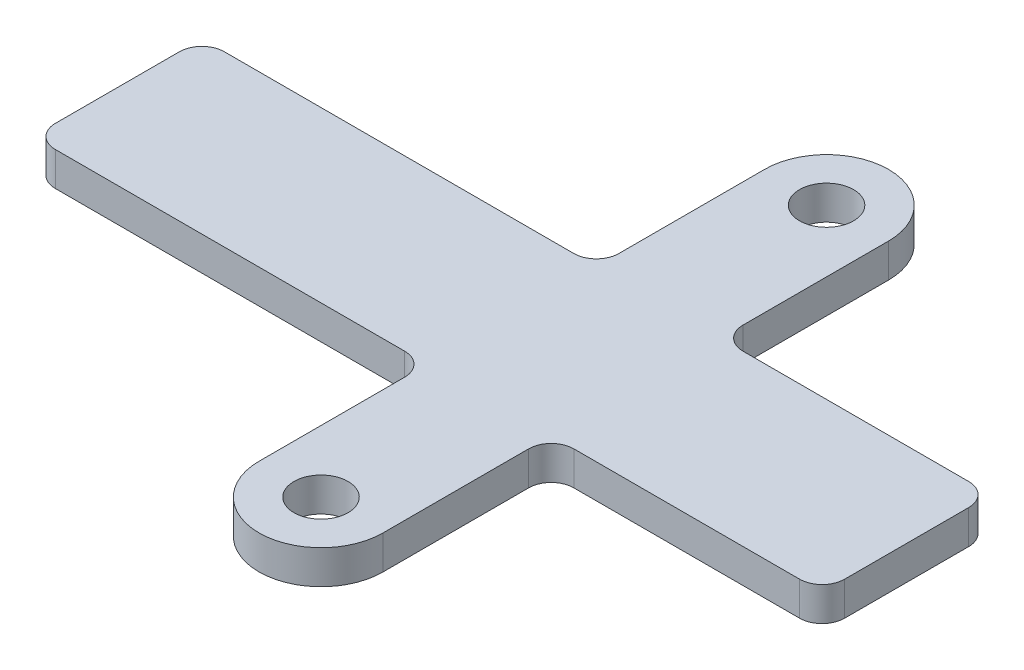
from build123d import *

# Parameters (mm, degrees)
BOSS_EXTRUDE1_DEPTH  = 1.5
M2_CLEARANCE_HOLE1_D = 2.4
FILLET1_R            = 1


with BuildPart() as part:
    # Sketch1 → Boss-Extrude1 (new body)
    with BuildSketch(Plane(origin=(0, 0, 0), x_dir=(1, 0, 0), z_dir=(0, 1, 0))):
        with BuildLine():
            ThreePointArc((2.75, 11.2072), (0, 13.9572), (-2.75, 11.2072))
            Line((-2.75, 11.2072), (-2.75, 3.75))
            Line((-2.75, 3.75), (-20.24, 3.75))
            Line((-20.24, 3.75), (-20.24, -3.75))
            Line((-20.24, -3.75), (-2.75, -3.75))
            Line((-2.75, -3.75), (-2.75, -11.2072))
            ThreePointArc((-2.75, -11.2072), (0, -13.9572), (2.75, -11.2072))
            Line((2.75, -11.2072), (2.75, -3.75))
            Line((2.75, -3.75), (14.76, -3.75))
            Line((14.76, -3.75), (14.76, 3.75))
            Line((14.76, 3.75), (2.75, 3.75))
            Line((2.75, 3.75), (2.75, 11.2072))
        make_face()
    extrude(amount=BOSS_EXTRUDE1_DEPTH)

    # M2 Clearance Hole1 (through all)
    with Locations(Plane(origin=(0, 0, -11.2072), x_dir=(0, 0, -1), z_dir=(0, -1, 0))):
        with Locations((0, 0), (-22.4144, 0)):
            Hole(M2_CLEARANCE_HOLE1_D / 2)

    # Fillet1
    fillet1_edges = [part.edges().sort_by_distance(p)[0] for p in [
        (2.75, 0.75, -3.75),
        (14.76, 0.75, -3.75),
        (14.76, 0.75, 3.75),
        (-20.24, 0.75, 3.75),
        (-20.24, 0.75, -3.75),
        (-2.75, 0.75, -3.75),
        (-2.75, 0.75, 3.75),
        (2.75, 0.75, 3.75),
    ]]
    fillet(fillet1_edges, radius=FILLET1_R)


solid = part.part
